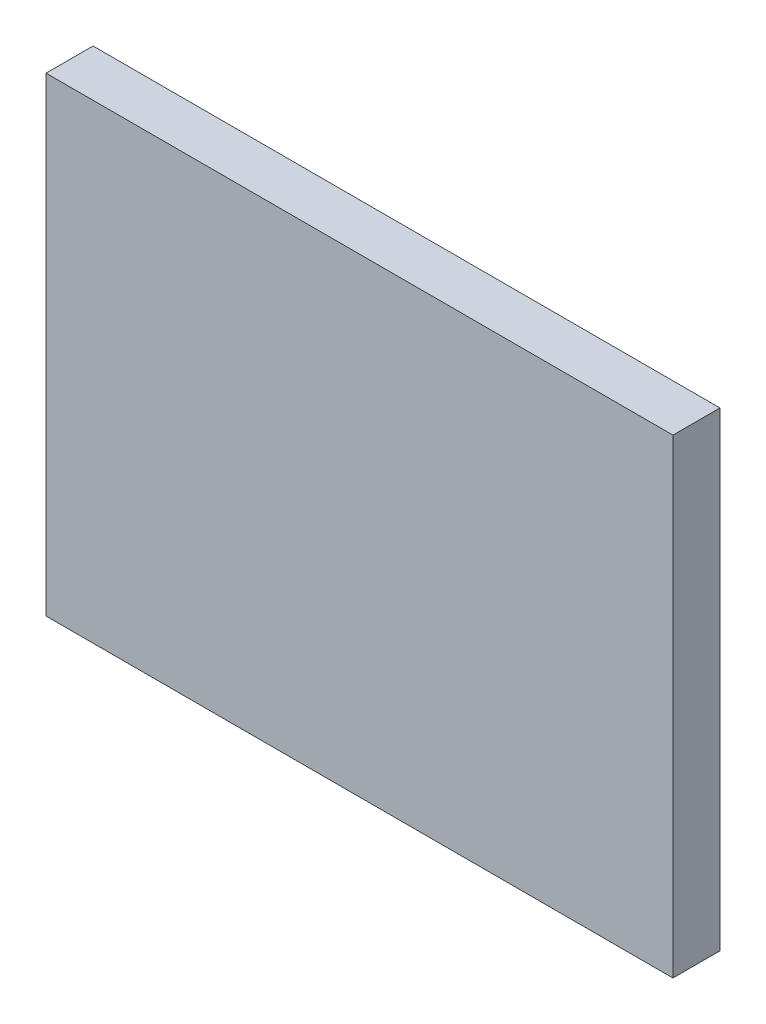
from build123d import *

# Parameters (mm, degrees)
SKETCH_1_W      = 40
SKETCH_1_H      = 30
EXTRUDE_1_DEPTH = 3


with BuildPart() as part:
    # Эскиз1 → Бобышка-Вытянуть1 (new body)
    with BuildSketch(Plane.XY):
        with Locations((20, 15)):
            Rectangle(SKETCH_1_W, SKETCH_1_H)
    extrude(amount=EXTRUDE_1_DEPTH)


solid = part.part
